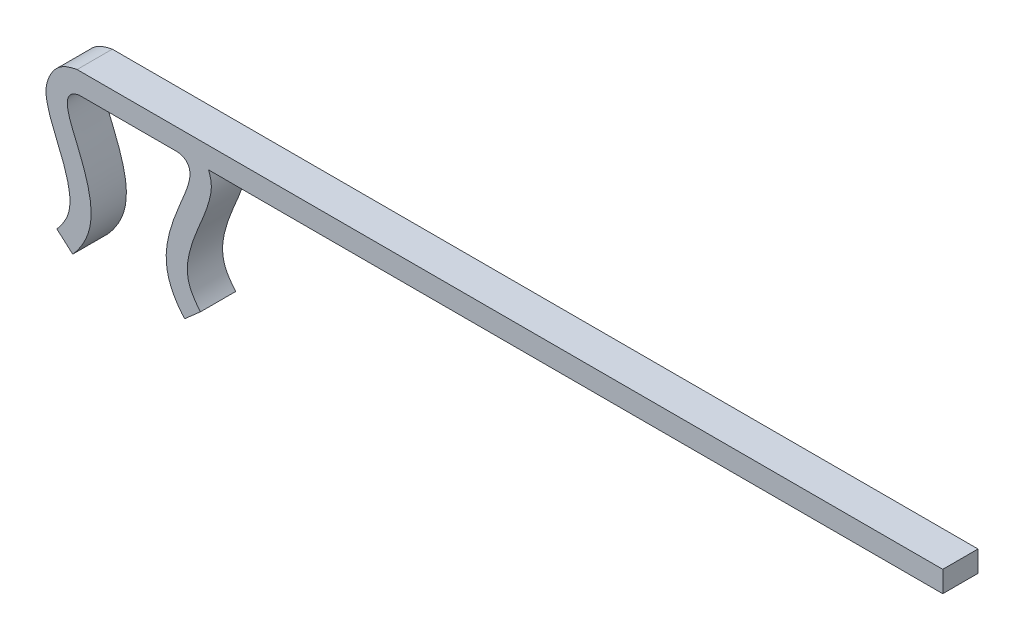
from build123d import *

# Parameters (mm, degrees)
BOSS_EXTRUDE1_DEPTH = 0.5


with BuildPart() as part:
    # Sketch1 → Boss-Extrude1 (new body)
    with BuildSketch(Plane.XY):
        with BuildLine():
            Line((-0.704103555, 2), (-0.55, 2))
            Line((-0.55, 2), (0.55, 2))
            Line((0.55, 2), (0.704103555, 2))
            add(Edge.make_bspline(
                [(0.704103555, 2), (0.984913182, 1.947600865), (0.653467277, 1.246091392), (0.440470999, 0.580993389), (0.657699293, 0.154588797), (0.793373681, 0)],
                knots=[0, 0, 0, 0, 0.316390632, 0.760407921, 1, 1, 1, 1], degree=3))
            Line((0.793373681, 0), (1.018850663, 0.197889189))
            add(Edge.make_bspline(
                [(1.133013434, 2), (1.145549027, 1.970086767), (1.186864012, 1.840956756), (1.15703676, 1.660917539), (1.074895189, 1.407428806), (0.957177151, 1.153930424), (0.869904633, 0.899603608), (0.827560013, 0.69321454), (0.834928932, 0.530060955), (0.877453, 0.38720653), (0.970734517, 0.252713221), (1.018850663, 0.197889189)],
                knots=[0.09695354, 0.09695354, 0.09695354, 0.09695354, 0.116035266, 0.179175604, 0.242315942, 0.368596619, 0.494877295, 0.621157971, 0.747438647, 0.873719324, 1, 1, 1, 1], degree=3))
            Line((1.133013434, 2), (11.55, 2))
            Line((11.55, 2), (11.55, 2.3))
            Line((11.55, 2.3), (0.55, 2.3))
            Line((0.55, 2.3), (-0.55, 2.3))
            Line((-0.55, 2.3), (-0.731854087, 2.3))
            add(Edge.make_bspline(
                [(-0.731854087, 2.3), (-0.749651334, 2.29667903), (-0.778982171, 2.292180164), (-0.886968809, 2.261943836), (-1.056729579, 2.171508628), (-1.195904507, 1.895525735), (-1.157036764, 1.660917538), (-1.074895193, 1.407428806), (-0.957177154, 1.153930424), (-0.869904635, 0.899603608), (-0.827560014, 0.693214541), (-0.834928933, 0.530060955), (-0.877453, 0.387206531), (-0.970734517, 0.252713221), (-1.018850663, 0.197889189)],
                knots=[-0.01024541, -0.01024541, -0.01024541, -0.01024541, 0.005539674, 0.021324759, 0.052894928, 0.116035266, 0.179175604, 0.242315942, 0.368596619, 0.494877295, 0.621157971, 0.747438647, 0.873719324, 1, 1, 1, 1], degree=3))
            Line((-1.018850663, 0.197889189), (-0.793373681, 0))
            add(Edge.make_bspline(
                [(-0.704103555, 2), (-0.984913182, 1.947600865), (-0.653467277, 1.246091392), (-0.440470999, 0.580993389), (-0.657699293, 0.154588797), (-0.793373681, 0)],
                knots=[0, 0, 0, 0, 0.316390632, 0.760407921, 1, 1, 1, 1], degree=3))
        make_face()
    extrude(amount=BOSS_EXTRUDE1_DEPTH)


solid = part.part
